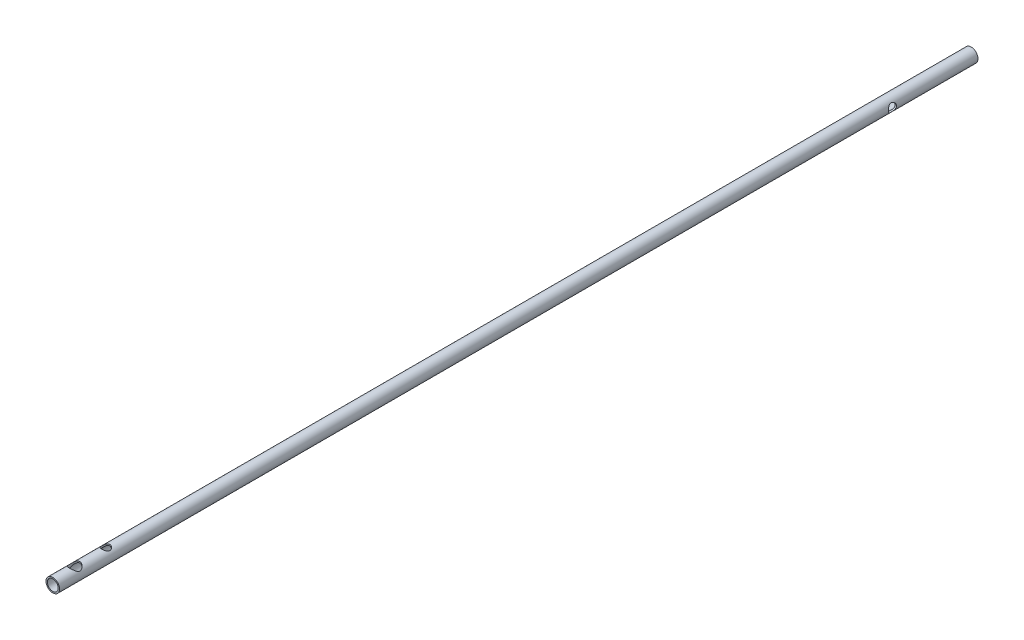
from build123d import *

# Parameters (mm, degrees)
SKETCH_1_R               = 5
SKETCH_1_R_2             = 4
EXTRUDE_1_DEPTH          = 676.5
CUT_EXTRUDE_1_DEPTH      = 677.536953906
CUT_EXTRUDE_1_DEPTH_BACK = 677.536953906
SKETCH_2_R               = 2
SKETCH_2_R_2             = 1.5
SKETCH_2_3_R             = 4
SKETCH_2_3_R_2           = 3
CUT_EXTRUDE_2_DEPTH      = 677.536954007
CUT_EXTRUDE_3_DEPTH      = 677.536954007
CUT_EXTRUDE_3_DEPTH_BACK = 677.536954007
SKETCH_3_R               = 1.5
SKETCH_3_3_R             = 3
CUT_EXTRUDE_4_DEPTH      = 10


with BuildPart() as part:
    # ｽｹｯﾁ1 → 押し出し-薄板1 (new body)
    with BuildSketch(Plane.XY):
        Circle(SKETCH_1_R)
        Circle(SKETCH_1_R_2, mode=Mode.SUBTRACT)
    extrude(amount=EXTRUDE_1_DEPTH)

    # ｽｹｯﾁ2 → ｶｯﾄ - 押し出し1 (cut, two sides: drawn at the far end of the back side and taken through both)
    with BuildSketch(Plane(origin=(0, 0, 0), x_dir=(1, 0, 0), z_dir=(0, 1, 0)).offset(-CUT_EXTRUDE_1_DEPTH_BACK)):
        with Locations((0, -660.5)):
            Circle(SKETCH_2_R)
        with Locations((0, -637.5)):
            Circle(SKETCH_2_R_2)
    extrude(amount=CUT_EXTRUDE_1_DEPTH + CUT_EXTRUDE_1_DEPTH_BACK, mode=Mode.SUBTRACT)

    # ｽｹｯﾁ2<3> → ｶｯﾄ - 押し出し2 (cut, through all)
    with BuildSketch(Plane(origin=(0, 0, 0), x_dir=(1, 0, 0), z_dir=(0, 1, 0))):
        with Locations((0, -660.5)):
            Circle(SKETCH_2_3_R)
        with Locations((0, -637.5)):
            Circle(SKETCH_2_3_R_2)
    extrude(amount=CUT_EXTRUDE_2_DEPTH, mode=Mode.SUBTRACT)

    # ｽｹｯﾁ3 → ｶｯﾄ - 押し出し3 (cut, two sides: drawn at the far end of the back side and taken through both)
    with BuildSketch(Plane(origin=(0, 0, 0), x_dir=(0, 0, -1), z_dir=(1, 0, 0)).offset(-CUT_EXTRUDE_3_DEPTH_BACK)):
        with Locations((-63, 0)):
            Circle(SKETCH_3_R)
    extrude(amount=CUT_EXTRUDE_3_DEPTH + CUT_EXTRUDE_3_DEPTH_BACK, mode=Mode.SUBTRACT)

    # ｽｹｯﾁ3<3> → ｶｯﾄ - 押し出し4 (cut)
    with BuildSketch(Plane(origin=(0, 0, 0), x_dir=(0, 0, -1), z_dir=(1, 0, 0))):
        with Locations((-63, 0)):
            Circle(SKETCH_3_3_R)
    extrude(amount=CUT_EXTRUDE_4_DEPTH, mode=Mode.SUBTRACT)


solid = part.part
